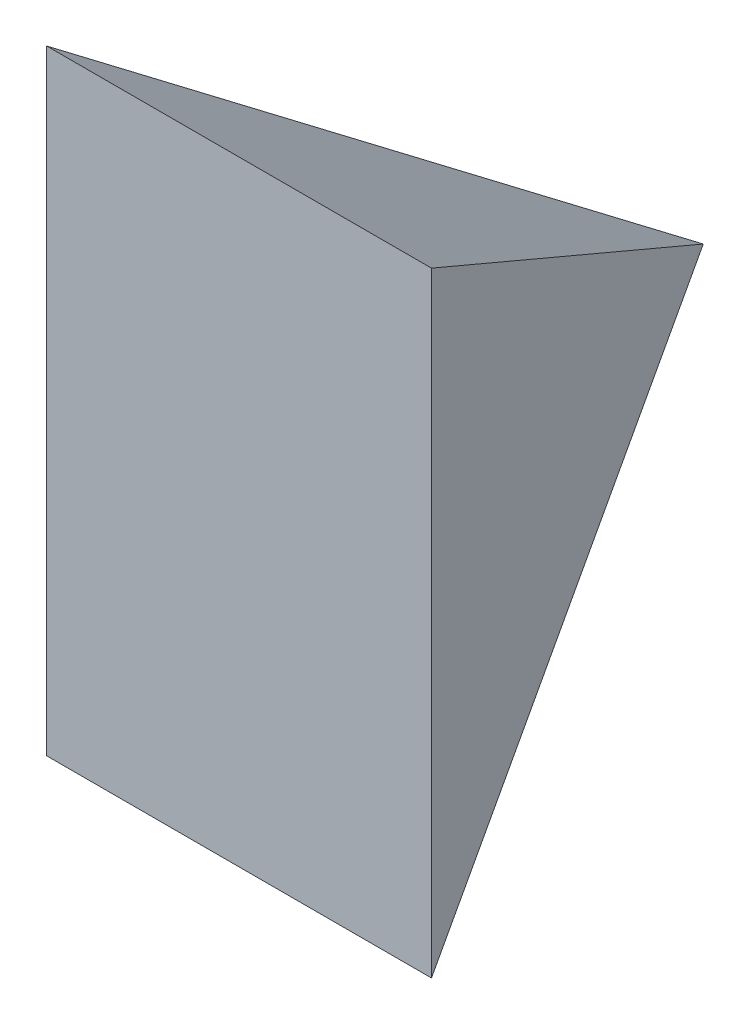
from build123d import *


with BuildPart() as part:
    # Esquisse2 → Lissage1 section 0
    with BuildSketch(Plane.XY.offset(450), mode=Mode.PRIVATE) as lissage1_s0:
        with BuildLine():
            Line((-186.5, 298), (186.5, 298))
            Line((186.5, 298), (186.5, -298))
            Line((186.5, -298), (-186.5, -298))
            Line((-186.5, -298), (-186.5, 298))
        make_face()
    loft([Vertex(0, 0, 0), lissage1_s0.sketch])


solid = part.part
